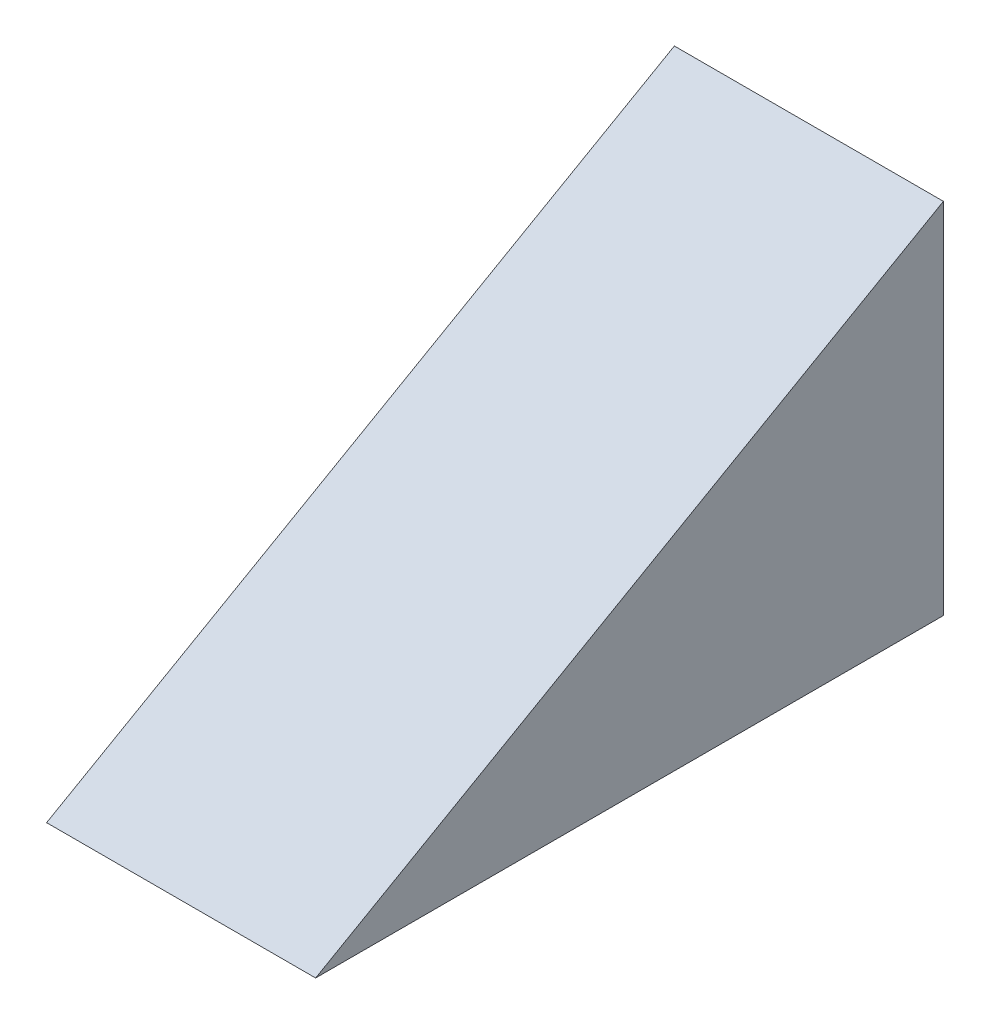
from build123d import *

# Parameters (mm, degrees)
BOSS_EXTRUDE1_DEPTH = 15


with BuildPart() as part:
    # Sketch1 → Boss-Extrude1 (new body)
    with BuildSketch(Plane(origin=(0, 0, 0), x_dir=(0, 0, -1), z_dir=(1, 0, 0))):
        Polygon((0, 0), (35, 0), (35, 20), align=None)
    extrude(amount=BOSS_EXTRUDE1_DEPTH)


solid = part.part
